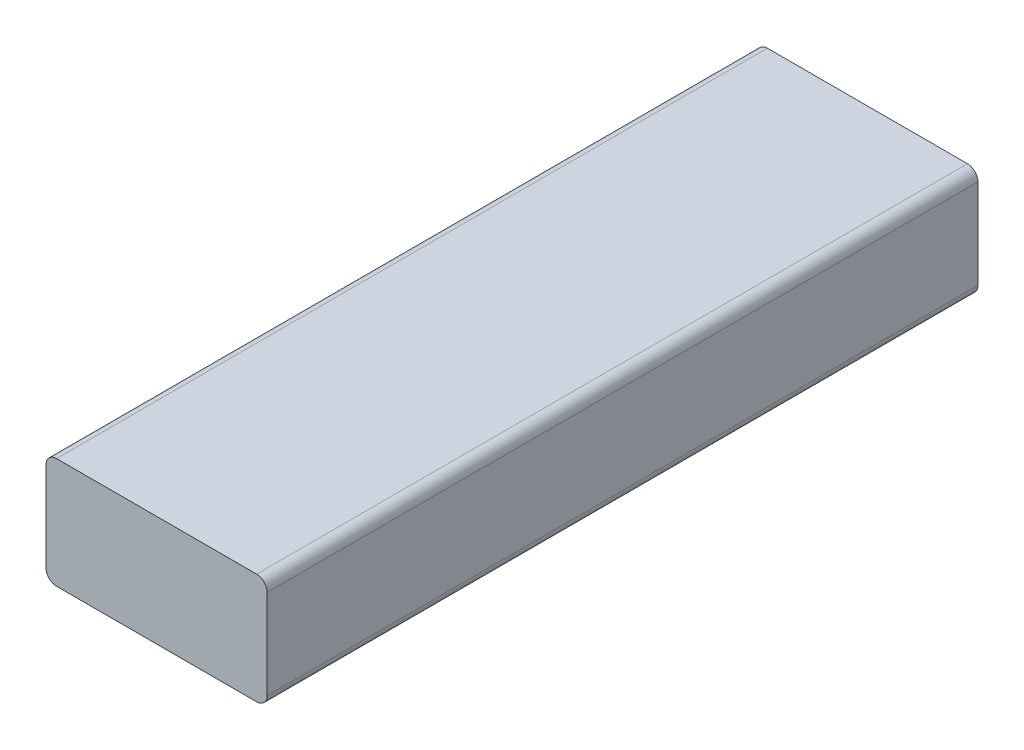
from build123d import *

# Parameters (mm, degrees)
SKETCH1_W           = 42
SKETCH1_H           = 135
BOSS_EXTRUDE1_DEPTH = 21
FILLET1_R           = 2


with BuildPart() as part:
    # Sketch1 → Boss-Extrude1 (new body)
    with BuildSketch(Plane(origin=(0, 0, 0), x_dir=(1, 0, 0), z_dir=(0, 1, 0))):
        with Locations((-5.0432147, 44.509057316)):
            Rectangle(SKETCH1_W, SKETCH1_H)
    extrude(amount=BOSS_EXTRUDE1_DEPTH)

    # Fillet1
    fillet1_edges = [part.edges().sort_by_distance(p)[0] for p in [
        (-26.0432147, 21, -44.509057316),
        (-26.0432147, 0, -44.509057316),
        (15.9567853, 0, -44.509057316),
        (15.9567853, 21, -44.509057316),
    ]]
    fillet(fillet1_edges, radius=FILLET1_R)


solid = part.part
